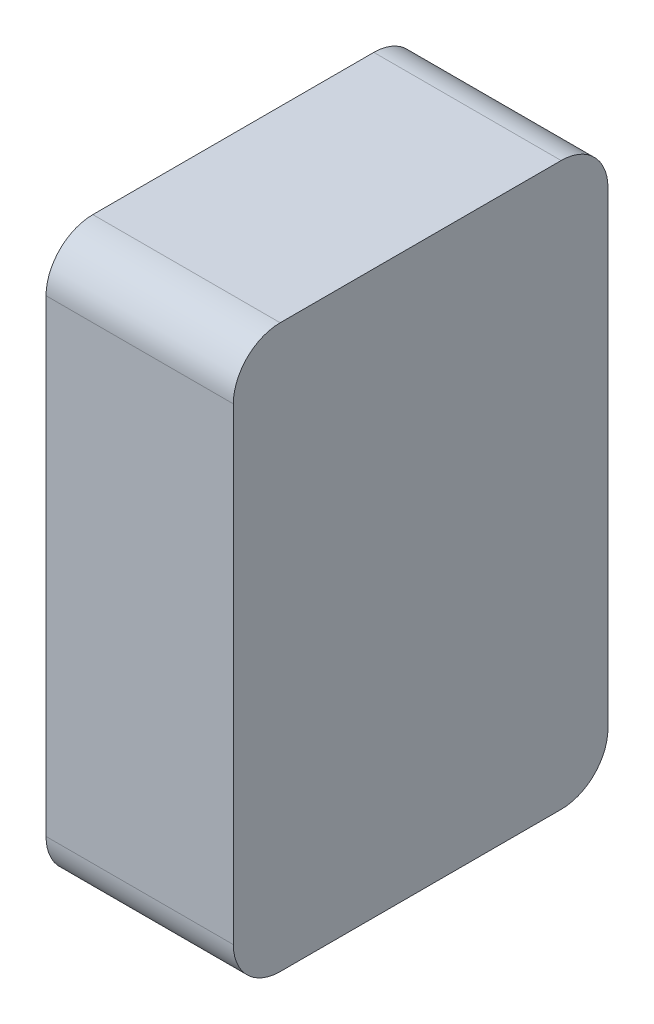
from build123d import *

# Parameters (mm, degrees)
BOSS_EXTRUDE1_DEPTH = 60
SKETCH3_R           = 45
CUT_EXTRUDE1_DEPTH  = 40
FILLET1_R           = 15


with BuildPart() as part:
    # Sketch2 → Boss-Extrude1 (new body)
    with BuildSketch(Plane(origin=(0, 0, 0), x_dir=(0, 0, -1), z_dir=(1, 0, 0))):
        Polygon((-60, 60), (-60, 120), (60, 120), (60, 60), (60, -60), (-60, -60), align=None)
    extrude(amount=BOSS_EXTRUDE1_DEPTH)

    # Sketch3 → Cut-Extrude1 (cut)
    with BuildSketch(Plane.ZY):
        Circle(SKETCH3_R)
    extrude(amount=-CUT_EXTRUDE1_DEPTH, mode=Mode.SUBTRACT)

    # Fillet1
    fillet1_edges = [part.edges().sort_by_distance(p)[0] for p in [
        (30, 120, 60),
        (30, 120, -60),
        (30, -60, -60),
        (30, -60, 60),
    ]]
    fillet(fillet1_edges, radius=FILLET1_R)


solid = part.part
